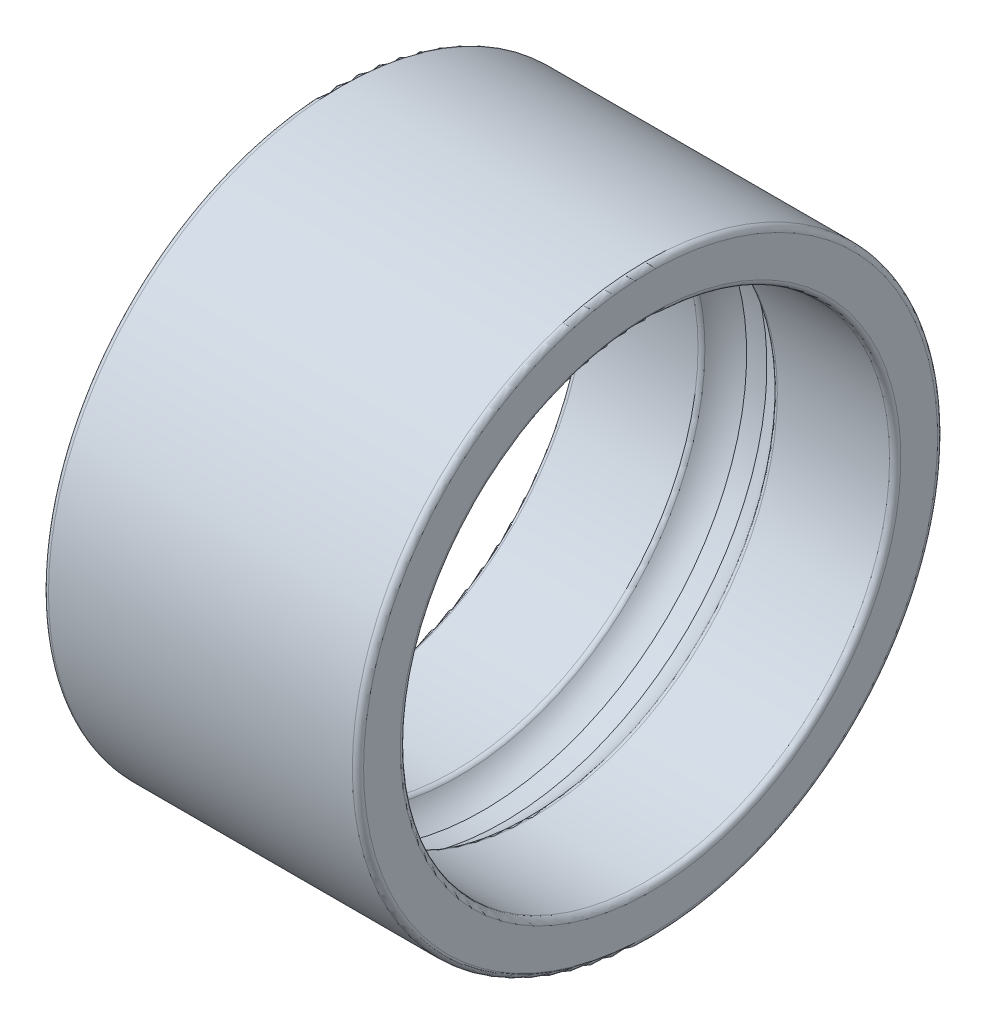
from build123d import *

# Parameters (mm, degrees)
FILLET1_R = 0.25


with BuildPart() as part:
    # Sketch1 → Revolve1 (revolve)
    with BuildSketch(Plane.XY, mode=Mode.PRIVATE) as revolve1_sk:
        with BuildLine():
            Line((0, 10.87), (0, 13))
            Line((0, 13), (14, 13))
            Line((14, 13), (14, 10.87))
            Line((14, 10.87), (8.628829459, 10.87))
            ThreePointArc((8.628829459, 10.87), (8.122946116, 11.410846188), (7.45, 11.72))
            Line((7.45, 11.72), (6.55, 11.72))
            ThreePointArc((6.55, 11.72), (5.877053884, 11.410846188), (5.371170541, 10.87))
            Line((5.371170541, 10.87), (0, 10.87))
        make_face()
    revolve(revolve1_sk.sketch.rotate(Axis((0, 0, 0), (1, 0, 0)), 90), axis=Axis((0, 0, 0), (1, 0, 0)))

    # Fillet1
    fillet1_edges = [part.edges().sort_by_distance(p)[0] for p in [
        (5.371170541, 0, -10.87),
        (8.628829459, 0, -10.87),
        (14, 0, -10.87),
        (14, 0, -13),
        (0, 0, -13),
        (0, 0, -10.87),
    ]]
    fillet(fillet1_edges, radius=FILLET1_R)


solid = part.part
